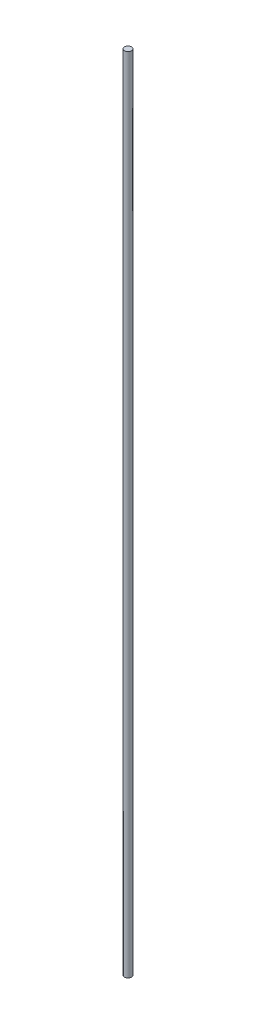
from build123d import *

# Parameters (mm, degrees)
SKETCH1_2_R         = 3.175
BOSS_EXTRUDE2_DEPTH = 730.25


with BuildPart() as part:
    # Sketch1<2> → Boss-Extrude2 (new body)
    with BuildSketch(Plane(origin=(0, 0, 0), x_dir=(1, 0, 0), z_dir=(0, 1, 0))):
        Circle(SKETCH1_2_R)
    extrude(amount=BOSS_EXTRUDE2_DEPTH)


solid = part.part
